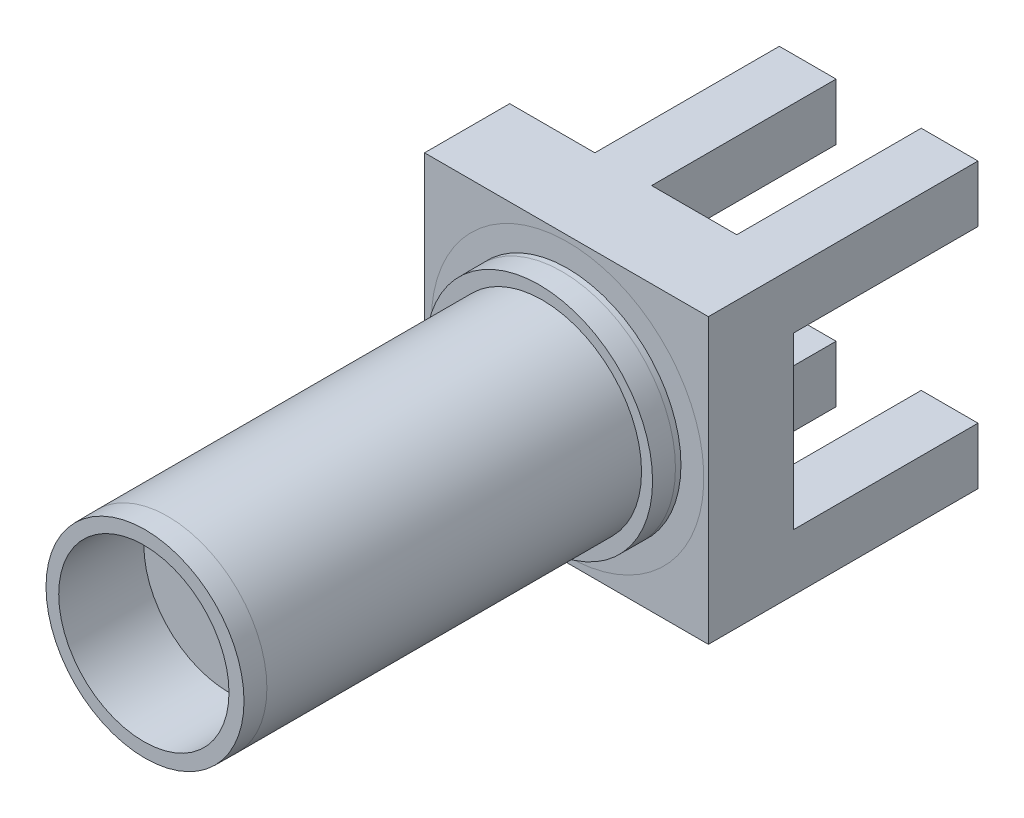
from build123d import *
from OCP.BRepFilletAPI import BRepFilletAPI_MakeChamfer

# Parameters (mm, degrees)
SKETCH1_W           = 10
SKETCH1_H           = 10
BOSS_EXTRUDE1_DEPTH = 3
SKETCH2_R           = 2.5
CUT_REVOLVE1_ANGLE  = 7
SKETCH3_W           = 2
SKETCH3_H           = 2
BOSS_EXTRUDE2_DEPTH = 6.5
SKETCH4_W           = 2
SKETCH4_H           = 2
BOSS_EXTRUDE3_DEPTH = 6.5
SKETCH5_W           = 2
SKETCH5_H           = 2
BOSS_EXTRUDE4_DEPTH = 6.5
SKETCH6_R           = 1
BOSS_EXTRUDE5_DEPTH = 6.5
CHAMFER2_SIZE       = 0.2
SKETCH7_R           = 4
BOSS_EXTRUDE6_DEPTH = 1
CHAMFER10_SIZE      = 0.8
CHAMFER10_SIZE2     = 0.006283315
SKETCH9_R           = 3.494836796
BOSS_EXTRUDE7_DEPTH = 14
CHAMFER11_SIZE      = 0.8
CHAMFER11_SIZE2     = 0.006283315
SKETCH11_R          = 3
CUT_EXTRUDE1_DEPTH  = 3
SKETCH12_R          = 0.75
CUT_EXTRUDE2_DEPTH  = 1


with BuildPart() as part:
    # Sketch1 → Boss-Extrude1 (new body)
    with BuildSketch(Plane.XY):
        with Locations((-6.146245059, 5)):
            Rectangle(SKETCH1_W, SKETCH1_H)
    extrude(amount=BOSS_EXTRUDE1_DEPTH)

    # Sketch2 → Cut-Revolve1 (revolve, cut)
    with BuildSketch(Plane.XY):
        with Locations((-6.146245059, 5)):
            Circle(SKETCH2_R)
    revolve(axis=Axis((-1.146245059, 0, 0), (0, 1, 0)), revolution_arc=CUT_REVOLVE1_ANGLE, mode=Mode.SUBTRACT)

    # Sketch3 → Boss-Extrude2 (add)
    with BuildSketch(Plane(origin=(0, 0, 0), x_dir=(-1, 0, 0), z_dir=(0, 0, -1))):
        with Locations((2.146245059, 1)):
            Rectangle(SKETCH3_W, SKETCH3_H)
    extrude(amount=BOSS_EXTRUDE2_DEPTH)

    # Sketch4 → Boss-Extrude3 (add)
    with BuildSketch(Plane(origin=(0, 0, 0), x_dir=(-1, 0, 0), z_dir=(0, 0, -1))):
        with Locations((7.146245059, 1)):
            Rectangle(SKETCH4_W, SKETCH4_H)
    extrude(amount=BOSS_EXTRUDE3_DEPTH)

    # Sketch5 → Boss-Extrude4 (add)
    with BuildSketch(Plane(origin=(0, 0, 0), x_dir=(-1, 0, 0), z_dir=(0, 0, -1))):
        with Locations((2.146245059, 9)):
            Rectangle(SKETCH5_W, SKETCH5_H)
        with Locations((7.146245059, 9)):
            Rectangle(SKETCH5_W, SKETCH5_H)
    extrude(amount=BOSS_EXTRUDE4_DEPTH)

    # Sketch7 → Boss-Extrude6 (add)
    with BuildSketch(Plane.XY.offset(3)):
        with Locations((-6.106175015, 5)):
            Circle(SKETCH7_R)
    extrude(amount=BOSS_EXTRUDE6_DEPTH)

    # Chamfer10: one chamfer whose edges measure the first distance from different faces: ONE call of the kernel's chamfer builder (chamfer() names one face for all edges)
    chamfer10_edges_1 = [part.edges().sort_by_distance(p)[0] for p in [
        (-10.106175015, 5, 3),
    ]]
    chamfer10_side_1 = [part.faces().sort_by_distance(p)[0] for p in [
        (-6.146245059, 0.141421356, 3),
    ]]
    chamfer10_edges_2 = [part.edges().sort_by_distance(p)[0] for p in [
        (-10.106175015, 5, 4),
    ]]
    chamfer10_side_2 = [part.faces().sort_by_distance(p)[0] for p in [
        (-10.106175015, 5, 3.5),
    ]]
    chamfer10 = BRepFilletAPI_MakeChamfer(part.part.solid().wrapped)
    for e in chamfer10_edges_1:
        chamfer10.Add(CHAMFER10_SIZE, CHAMFER10_SIZE2, e.wrapped, chamfer10_side_1[0].wrapped)  # the first distance lies on this face
    for e in chamfer10_edges_2:
        chamfer10.Add(CHAMFER10_SIZE, CHAMFER10_SIZE2, e.wrapped, chamfer10_side_2[0].wrapped)  # the first distance lies on this face
    add(Compound.cast(chamfer10.Shape()), mode=Mode.REPLACE)

    # Sketch9 → Boss-Extrude7 (add)
    with BuildSketch(Plane.XY.offset(4)):
        with Locations((-5.996019597, 5.089264212)):
            Circle(SKETCH9_R)
    extrude(amount=BOSS_EXTRUDE7_DEPTH)

    # Chamfer11
    chamfer11_edges = [part.edges().sort_by_distance(p)[0] for p in [
        (-9.490856393, 5.089264212, 18),
    ]]
    chamfer11_side = [part.faces().sort_by_distance(p)[0] for p in [
        (-9.490856393, 5.089264212, 11),
    ]]
    chamfer(chamfer11_edges, length=CHAMFER11_SIZE, length2=CHAMFER11_SIZE2, reference=chamfer11_side[0])

    # Sketch11 → Cut-Extrude1 (cut)
    with BuildSketch(Plane.XY.offset(18)):
        with Locations((-6.03702539, 5.085040529)):
            Circle(SKETCH11_R)
    extrude(amount=-CUT_EXTRUDE1_DEPTH, mode=Mode.SUBTRACT)

    # Sketch12 → Cut-Extrude2 (cut)
    with BuildSketch(Plane.XY.offset(15)):
        with Locations((-6.057436588, 4.916159933)):
            Circle(SKETCH12_R)
    extrude(amount=-CUT_EXTRUDE2_DEPTH, mode=Mode.SUBTRACT)


with BuildPart() as body_2:
    # Sketch6 → Boss-Extrude5 (new body)
    with BuildSketch(Plane(origin=(0, 0, 0), x_dir=(-1, 0, 0), z_dir=(0, 0, -1))):
        with Locations(Location((6.146245059, 5, 0), (0, 0, 180))):
            Circle(SKETCH6_R)
    extrude(amount=BOSS_EXTRUDE5_DEPTH)

    # Chamfer2
    chamfer2_edges = [body_2.edges().sort_by_distance(p)[0] for p in [
        (-7.146245059, 5, -6.5),
    ]]
    chamfer(chamfer2_edges, length=CHAMFER2_SIZE)


solid = Compound([part.part, body_2.part])
